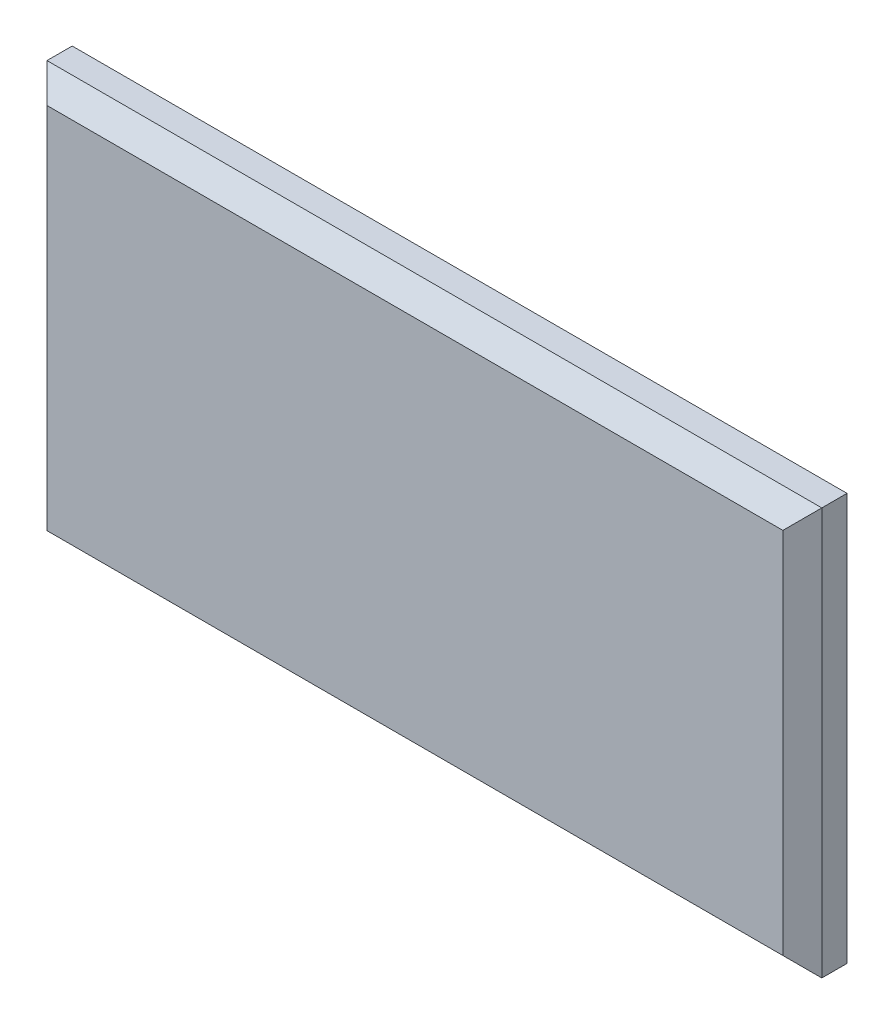
from build123d import *

# Parameters (mm, degrees)
BOSS_EXTRUDE2_DEPTH = 0.059386
CUT_EXTRUDE2_DEPTH  = 1.131952574
CUT_EXTRUDE6_DEPTH  = 1.131952731
SKETCH14_W          = 0.0013
SKETCH14_H          = 0.0125
CUT_EXTRUDE7_DEPTH  = 0.005
SKETCH15_W          = 0.108021848
SKETCH15_H          = 0.054386384
CUT_EXTRUDE8_DEPTH  = 0.005


with BuildPart() as part:
    # Sketch6 → Boss-Extrude2 (new body)
    with BuildSketch(Plane(origin=(0, -0.029692013, 0), x_dir=(1, 0, 0), z_dir=(0, 1, 0))):
        Polygon((-0.05760873, -0.044406825), (-0.054770597, -0.041568568), (0.052574986, -0.041568568), (0.055413118, -0.044406577), (0.055413118, -0.058446429), (0.052574986, -0.061284671), (-0.054770597, -0.061284671), (-0.05760873, -0.058446647), align=None)
    extrude(amount=BOSS_EXTRUDE2_DEPTH)

    # Sketch10 → Cut-Extrude2 (cut, through all)
    with BuildSketch(Plane(origin=(-0.05760873, 0, 0), x_dir=(0, 0, -1), z_dir=(1, 0, 0))):
        Polygon((-0.061284671, 0.02685612), (-0.058446429, 0.029694371), (-0.061284671, 0.029694371), align=None)
        Polygon((-0.041568568, 0.02685612), (-0.044406577, 0.029694371), (-0.041568568, 0.029694371), align=None)
        Polygon((-0.058446429, -0.029692013), (-0.061284671, -0.026853766), (-0.061284671, -0.029692013), align=None)
        Polygon((-0.044406825, -0.029692013), (-0.041568568, -0.026853766), (-0.041568568, -0.029692013), align=None)
    extrude(amount=CUT_EXTRUDE2_DEPTH, mode=Mode.SUBTRACT)

    # Sketch11 → Cut-Extrude6 (cut, through all)
    with BuildSketch(Plane.ZY.offset(0.05760873)):
        Polygon((0.054768568, 0.029694371), (0.054768568, -0.029692013), (0.044406825, -0.029692013), (0.041568568, -0.026853766), (0.041568568, 0.02685612), (0.044406825, 0.029694371), align=None)
    extrude(amount=-CUT_EXTRUDE6_DEPTH, mode=Mode.SUBTRACT)

    # Sketch14 → Cut-Extrude7 (cut)
    with BuildSketch(Plane.ZY.offset(0.05760873)):
        with Locations((0.055418568, 1.179e-06)):
            Rectangle(SKETCH14_W, SKETCH14_H)
    extrude(amount=-CUT_EXTRUDE7_DEPTH, mode=Mode.SUBTRACT)

    # Sketch15 → Cut-Extrude8 (cut)
    with BuildSketch(Plane(origin=(0, 0, 0.054768568), x_dir=(-1, 0, 0), z_dir=(0, 0, -1))):
        with Locations((0.001097806, 1.179e-06)):
            Rectangle(SKETCH15_W, SKETCH15_H)
    extrude(amount=-CUT_EXTRUDE8_DEPTH, mode=Mode.SUBTRACT)


solid = part.part
